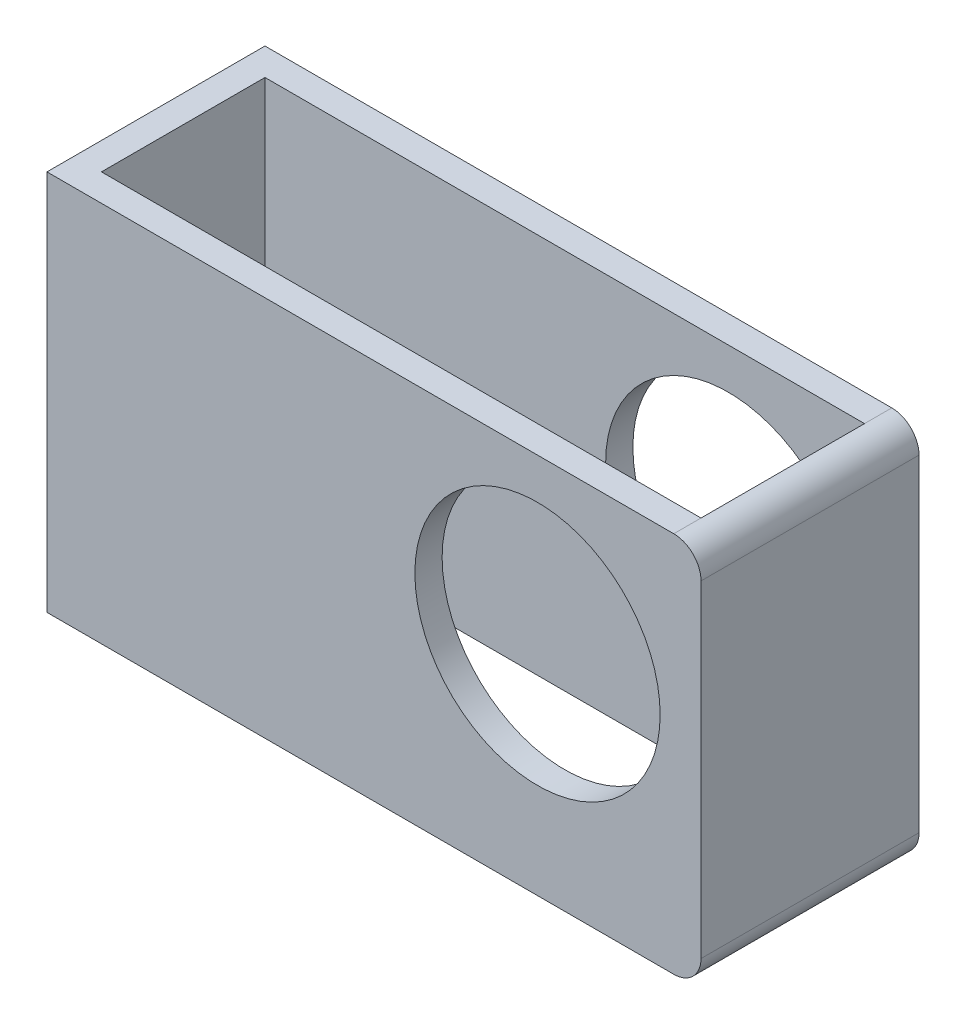
from build123d import *

# Parameters (mm, degrees)
SKETCH1_W                       = 76.2
SKETCH1_H                       = 44.45
SKETCH1_R                       = 14.2875
BOSS_EXTRUDE1_DEPTH             = 12.7
FILLET1_R                       = 3.175
SKETCH3_W                       = 69.85
SKETCH3_H                       = 19.05
CUT_EXTRUDE2_DEPTH              = 60.905780189
F_1_4_0_25_DIAMETER_HOLE1_D     = 6.35
F_1_4_0_25_DIAMETER_HOLE1_DEPTH = 5.08
F_1_4_0_25_DIAMETER_HOLE1_TIP   = 1.907732465


with BuildPart() as part:
    # Sketch1 → Boss-Extrude1 (new, symmetric)
    with BuildSketch(Plane.XY):
        Rectangle(SKETCH1_W, SKETCH1_H)
        with Locations((19.05, 3.175)):
            Circle(SKETCH1_R, mode=Mode.SUBTRACT)
    extrude(amount=BOSS_EXTRUDE1_DEPTH, both=True)

    # Fillet1
    fillet1_edges = [part.edges().sort_by_distance(p)[0] for p in [
        (38.1, -22.225, 0),
        (38.1, 22.225, 0),
    ]]
    fillet(fillet1_edges, radius=FILLET1_R)

    # Sketch3 → Cut-Extrude2 (cut, through all)
    with BuildSketch(Plane.XZ.offset(22.225)):
        Rectangle(SKETCH3_W, SKETCH3_H)
    extrude(amount=-CUT_EXTRUDE2_DEPTH, mode=Mode.SUBTRACT)

    # 1/4 (0.25) Diameter Hole1
    with Locations(Plane.ZY.offset(38.1)):
        with Locations((0, 6.35), (0, -12.7)):
            Hole(F_1_4_0_25_DIAMETER_HOLE1_D / 2, depth=F_1_4_0_25_DIAMETER_HOLE1_DEPTH)
            with Locations((0, 0, -(F_1_4_0_25_DIAMETER_HOLE1_DEPTH + F_1_4_0_25_DIAMETER_HOLE1_TIP / 2))):  # 118° drill point
                Cone(0, F_1_4_0_25_DIAMETER_HOLE1_D / 2, F_1_4_0_25_DIAMETER_HOLE1_TIP, mode=Mode.SUBTRACT)


solid = part.part
